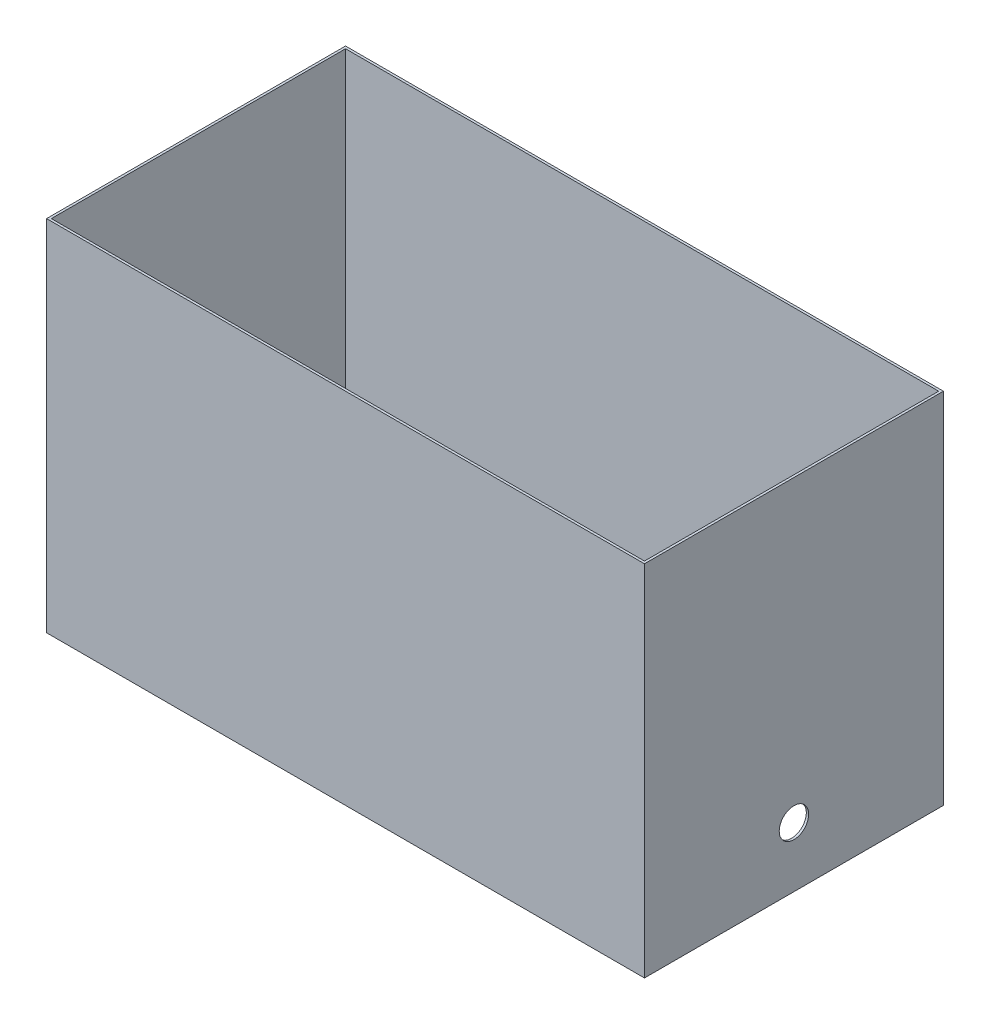
from build123d import *

# Parameters (mm, degrees)
SKETCH1_W           = 508
SKETCH1_H           = 254
SKETCH1_W_2         = 504
SKETCH1_H_2         = 250
BOSS_EXTRUDE1_DEPTH = 304.8
SKETCH2_R           = 12.5
CUT_EXTRUDE1_DEPTH  = 606.884510447


with BuildPart() as part:
    # Sketch1 → Boss-Extrude1 (new body)
    with BuildSketch(Plane(origin=(0, 0, 0), x_dir=(1, 0, 0), z_dir=(0, 1, 0))):
        Rectangle(SKETCH1_W, SKETCH1_H)
        Rectangle(SKETCH1_W_2, SKETCH1_H_2, mode=Mode.SUBTRACT)
    extrude(amount=BOSS_EXTRUDE1_DEPTH)

    # Sketch2 → Cut-Extrude1 (cut, through all)
    with BuildSketch(Plane.ZY.offset(254)):
        with Locations((0, 50.8)):
            Circle(SKETCH2_R)
    extrude(amount=-CUT_EXTRUDE1_DEPTH, mode=Mode.SUBTRACT)


solid = part.part
